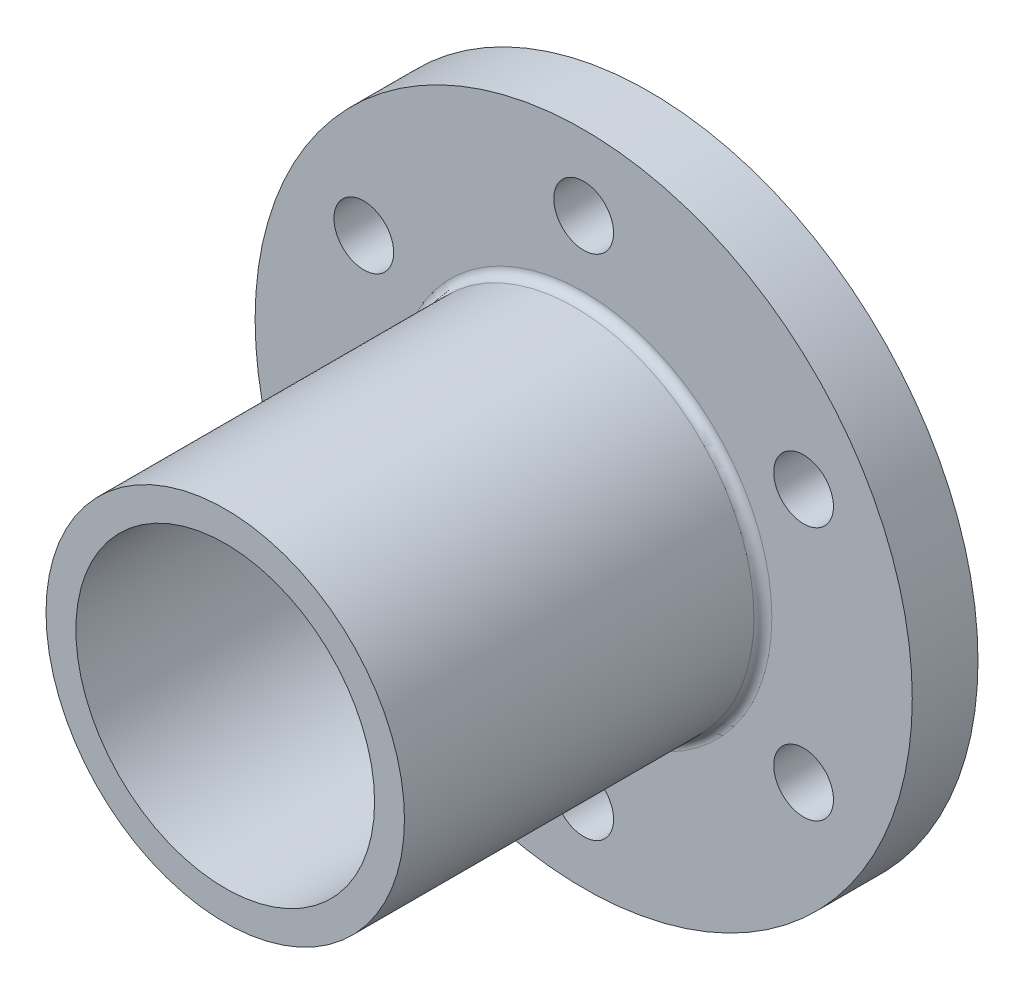
from build123d import *

# Parameters (mm, degrees)
SKETCH1_R           = 110
BOSS_EXTRUDE1_DEPTH = 22
SKETCH2_R           = 60
BOSS_EXTRUDE2_DEPTH = 120
SKETCH3_R           = 50
CUT_EXTRUDE1_DEPTH  = 211.627633515
SKETCH4_R           = 10
CUT_EXTRUDE2_DEPTH  = 197.468827044
FILLET1_R           = 3


with BuildPart() as part:
    # Sketch1 → Boss-Extrude1 (new body)
    with BuildSketch(Plane.XY):
        Circle(SKETCH1_R)
    extrude(amount=BOSS_EXTRUDE1_DEPTH)

    # Sketch2 → Boss-Extrude2 (add)
    with BuildSketch(Plane.XY.offset(22)):
        Circle(SKETCH2_R)
    extrude(amount=BOSS_EXTRUDE2_DEPTH)

    # Sketch3 → Cut-Extrude1 (cut, through all)
    with BuildSketch(Plane.XY.offset(142)):
        Circle(SKETCH3_R)
    extrude(amount=-CUT_EXTRUDE1_DEPTH, mode=Mode.SUBTRACT)

    # Sketch4 → Cut-Extrude2 (cut, through all)
    with BuildSketch(Plane.XY.offset(22)):
        with Locations((0, 85)):
            Circle(SKETCH4_R)
        with Locations((73.612159322, 42.5)):
            Circle(SKETCH4_R)
        with Locations((73.612159322, -42.5)):
            Circle(SKETCH4_R)
        with Locations((0, -85)):
            Circle(SKETCH4_R)
        with Locations((-73.612159322, -42.5)):
            Circle(SKETCH4_R)
        with Locations((-73.612159322, 42.5)):
            Circle(SKETCH4_R)
    extrude(amount=-CUT_EXTRUDE2_DEPTH, mode=Mode.SUBTRACT)

    # Fillet1
    fillet1_edges = [part.edges().sort_by_distance(p)[0] for p in [
        (-60, 0, 22),
    ]]
    fillet(fillet1_edges, radius=FILLET1_R)


solid = part.part
